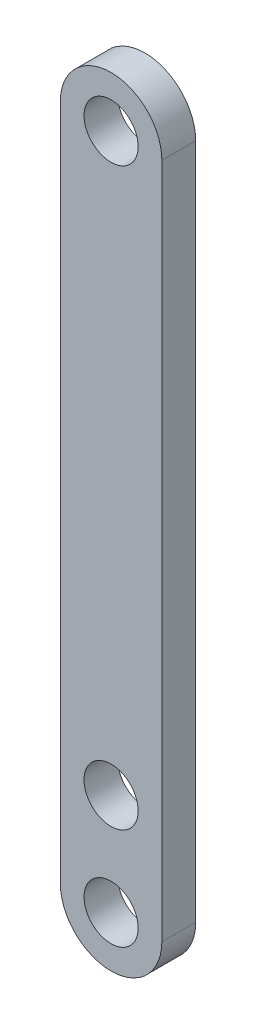
from build123d import *

# Parameters (mm, degrees)
SCHIZZO1_R        = 4
ESTRUSIONE1_DEPTH = 5


with BuildPart() as part:
    # Schizzo1 → Estrusione1 (new body)
    with BuildSketch(Plane.XY):
        with BuildLine():
            Line((-7.5, -50), (-7.5, 50))
            ThreePointArc((-7.5, 50), (0, 57.5), (7.5, 50))
            Line((7.5, 50), (7.5, -50))
            ThreePointArc((7.5, -50), (0, -57.5), (-7.5, -50))
        make_face()
        with Locations((0, 50)):
            Circle(SCHIZZO1_R, mode=Mode.SUBTRACT)
        with Locations((0, -35)):
            Circle(SCHIZZO1_R, mode=Mode.SUBTRACT)
        with Locations((0, -50)):
            Circle(SCHIZZO1_R, mode=Mode.SUBTRACT)
    extrude(amount=ESTRUSIONE1_DEPTH)


solid = part.part
